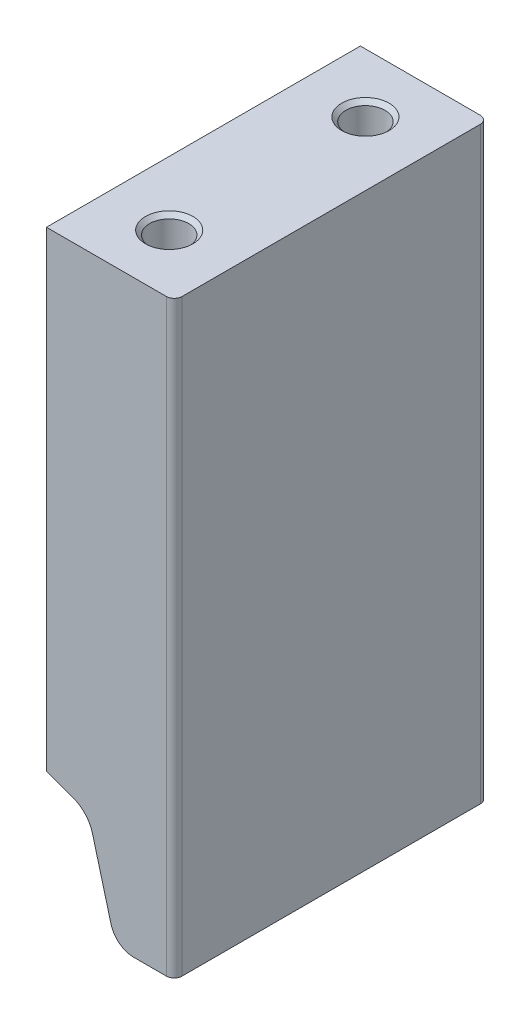
from build123d import *

# Parameters (mm, degrees)
SKETCH1_W                   = 16.28
SKETCH1_H                   = 40
BOSS_EXTRUDE1_DEPTH         = 75
CUT_EXTRUDE1_REACH          = 87.389
FILLET1_R                   = 3
FILLET2_R                   = 1
M6_TAPPED_HOLE1_D           = 5
M6_TAPPED_HOLE1_DEPTH       = 17
M6_TAPPED_HOLE1_CSINK_D     = 6.05
M6_TAPPED_HOLE1_CSINK_ANGLE = 90
M6_TAPPED_HOLE1_TIP         = 1.502151548


with BuildPart() as part:
    # Sketch1 → Boss-Extrude1 (new body)
    with BuildSketch(Plane(origin=(0, 0, 0), x_dir=(1, 0, 0), z_dir=(0, 1, 0))):
        Rectangle(SKETCH1_W, SKETCH1_H)
    extrude(amount=-BOSS_EXTRUDE1_DEPTH)

    # Sketch2 → Cut-Extrude1 (cut, up to next)
    with BuildSketch(Plane.XY.offset(20), mode=Mode.PRIVATE) as cut_extrude1_sk1:
        with BuildLine():
            Line((-4.771919427, -61.241229517), (-8.14, -60.015348442))
            Line((-8.14, -60.015348442), (-8.14, -75))
            Line((-8.14, -75), (0.680596646, -75))
            Line((0.680596646, -75), (-2.276296695, -63.96472382))
            ThreePointArc((-2.276296695, -63.96472382), (-3.190890653, -62.29763917), (-4.771919427, -61.241229517))
        make_face()
    cut_extrude1_tool1 = extrude(cut_extrude1_sk1.sketch, amount=-CUT_EXTRUDE1_REACH, mode=Mode.PRIVATE) & part.part
    add(cut_extrude1_tool1.solids().sort_by_distance((-4.638946, -68.648794, 20))[0], mode=Mode.SUBTRACT)

    # Fillet1
    fillet1_edges = [part.edges().sort_by_distance(p)[0] for p in [
        (0.680596646, -75, 0),
    ]]
    fillet(fillet1_edges, radius=FILLET1_R)

    # Fillet2
    fillet2_edges = [part.edges().sort_by_distance(p)[0] for p in [
        (8.14, -37.5, 20),
        (8.14, -37.5, -20),
    ]]
    fillet(fillet2_edges, radius=FILLET2_R)

    # M6 Tapped Hole1
    with Locations(Plane(origin=(0, 0, 0), x_dir=(1, 0, 0), z_dir=(0, 1, 0))):
        with Locations((0, 12.5), (0, -12.5)):
            CounterSinkHole(M6_TAPPED_HOLE1_D / 2, M6_TAPPED_HOLE1_CSINK_D / 2, depth=M6_TAPPED_HOLE1_DEPTH, counter_sink_angle=M6_TAPPED_HOLE1_CSINK_ANGLE)
            with Locations((0, 0, -(M6_TAPPED_HOLE1_DEPTH + M6_TAPPED_HOLE1_TIP / 2))):  # 118° drill point
                Cone(0, M6_TAPPED_HOLE1_D / 2, M6_TAPPED_HOLE1_TIP, mode=Mode.SUBTRACT)


solid = part.part
